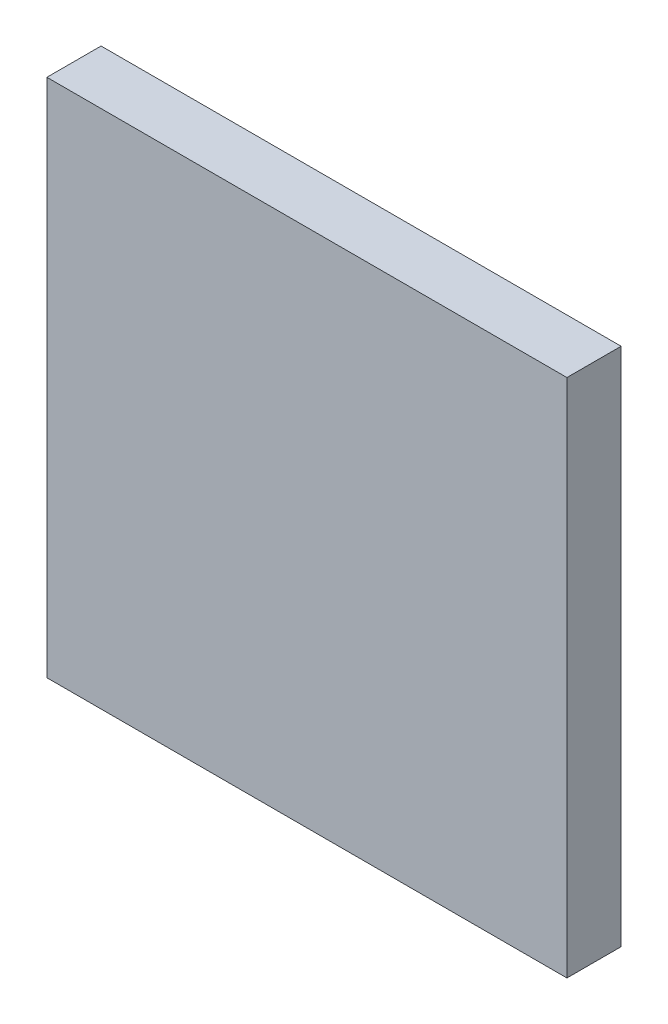
from build123d import *

# Parameters (mm, degrees)
SKETCH1_W           = 96
SKETCH1_H           = 96
BOSS_EXTRUDE1_DEPTH = 5


with BuildPart() as part:
    # Sketch1 → Boss-Extrude1 (new, symmetric)
    with BuildSketch(Plane.XY):
        Rectangle(SKETCH1_W, SKETCH1_H)
    extrude(amount=BOSS_EXTRUDE1_DEPTH, both=True)


solid = part.part
